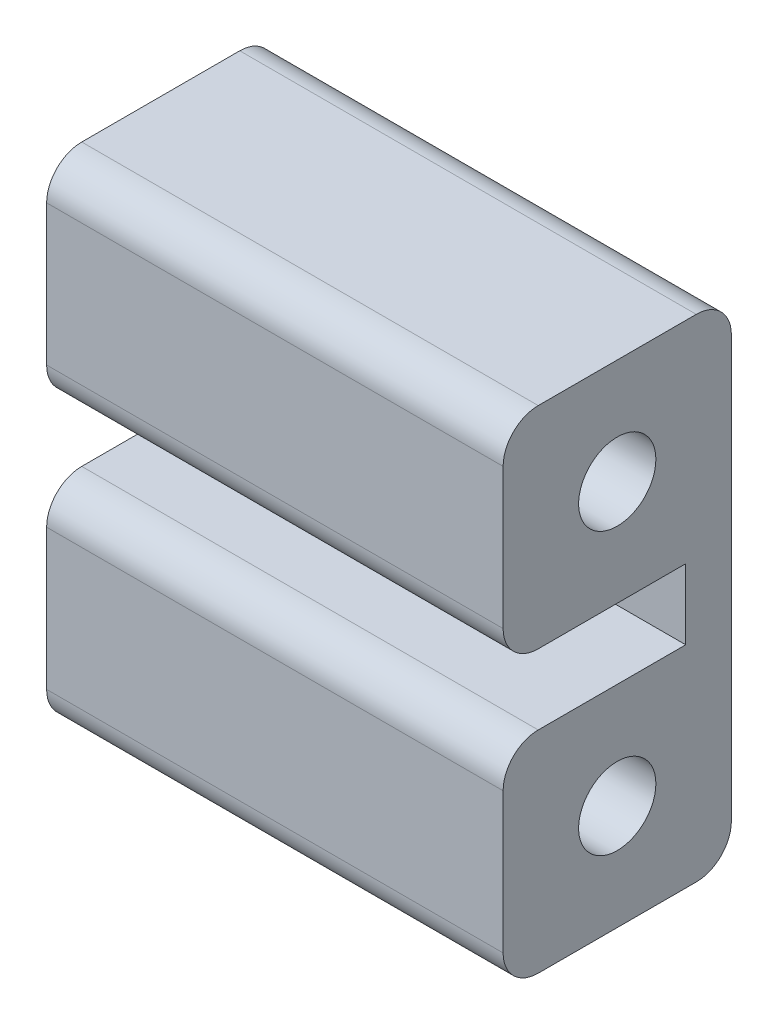
from build123d import *

# Parameters (mm, degrees)
SKETCH_1_R      = 1.1
EXTRUDE_1_DEPTH = 13
FILLET_1_R      = 1


with BuildPart() as part:
    # 草图1 → 凸台-拉伸1 (new body)
    with BuildSketch(Plane(origin=(0, 0, 0), x_dir=(0, 0, -1), z_dir=(1, 0, 0))):
        Polygon((3.25, 7), (-3.25, 7), (-3.25, 1), (1.95, 1), (1.95, -1), (-3.25, -1), (-3.25, -7), (3.25, -7), align=None)
        with Locations((0, -4)):
            Circle(SKETCH_1_R, mode=Mode.SUBTRACT)
        with Locations((0, 4)):
            Circle(SKETCH_1_R, mode=Mode.SUBTRACT)
    extrude(amount=-EXTRUDE_1_DEPTH)

    # 圆角1
    fillet_1_edges = [part.edges().sort_by_distance(p)[0] for p in [
        (-6.5, 1, 3.25),
        (-6.5, 7, 3.25),
        (-6.5, 7, -3.25),
        (-6.5, -7, -3.25),
        (-6.5, -7, 3.25),
        (-6.5, -1, 3.25),
    ]]
    fillet(fillet_1_edges, radius=FILLET_1_R)


solid = part.part
